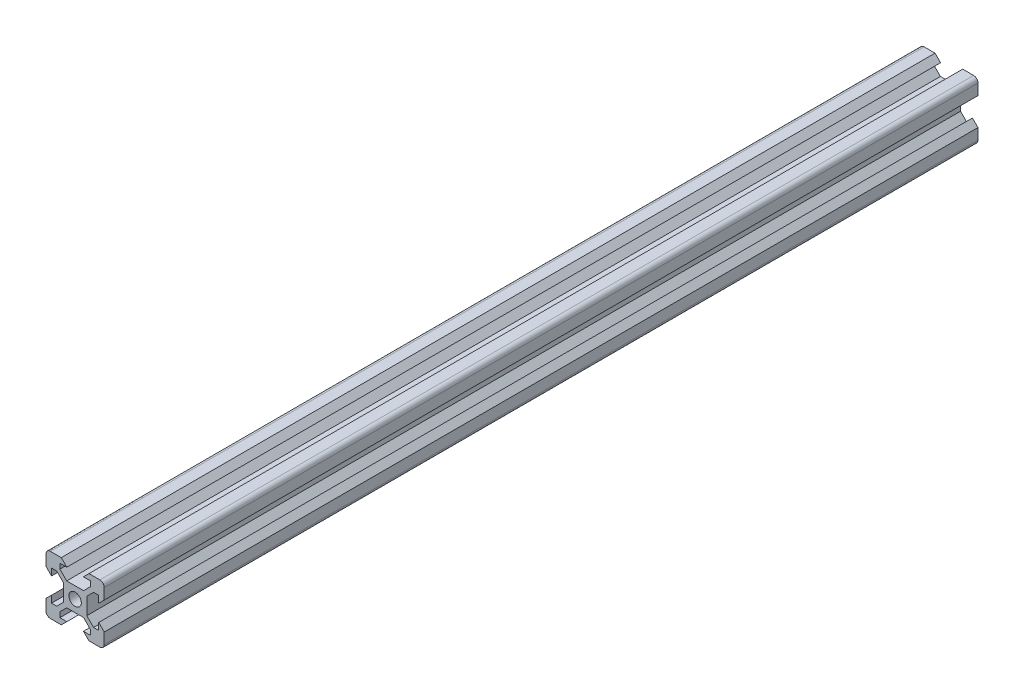
from build123d import *

# Parameters (mm, degrees)
SKETCH1_R           = 2.125
BOSS_EXTRUDE1_DEPTH = 300


with BuildPart() as part:
    # Sketch1 → Boss-Extrude1 (new body)
    with BuildSketch(Plane.XY):
        with BuildLine():
            Line((8.1, 5.225), (8.1, 2.85))
            Line((8.1, 2.85), (10, 4.75))
            Line((10, 4.75), (10, 8.5))
            ThreePointArc((10, 8.5), (9.560660172, 9.560660172), (8.5, 10))
            Line((8.5, 10), (4.75, 10))
            Line((4.75, 10), (2.85, 8.1))
            Line((2.85, 8.1), (5.225, 8.1))
            Line((5.225, 8.1), (5.225, 6.325))
            Line((5.225, 6.325), (2.9, 4))
            Line((2.9, 4), (-2.9, 4))
            Line((-2.9, 4), (-5.225, 6.325))
            Line((-5.225, 6.325), (-5.225, 8.1))
            Line((-5.225, 8.1), (-2.85, 8.1))
            Line((-2.85, 8.1), (-4.75, 10))
            Line((-4.75, 10), (-8.5, 10))
            ThreePointArc((-8.5, 10), (-9.560660172, 9.560660172), (-10, 8.5))
            Line((-10, 8.5), (-10, 4.75))
            Line((-10, 4.75), (-8.1, 2.85))
            Line((-8.1, 2.85), (-8.1, 5.225))
            Line((-8.1, 5.225), (-6.325, 5.225))
            Line((-6.325, 5.225), (-4, 2.9))
            Line((-4, 2.9), (-4, -2.9))
            Line((-4, -2.9), (-6.325, -5.225))
            Line((-6.325, -5.225), (-8.1, -5.225))
            Line((-8.1, -5.225), (-8.1, -2.85))
            Line((-8.1, -2.85), (-10, -4.75))
            Line((-10, -4.75), (-10, -8.5))
            ThreePointArc((-10, -8.5), (-9.560660172, -9.560660172), (-8.5, -10))
            Line((-8.5, -10), (-4.75, -10))
            Line((-4.75, -10), (-2.85, -8.1))
            Line((-2.85, -8.1), (-5.225, -8.1))
            Line((-5.225, -8.1), (-5.225, -6.325))
            Line((-5.225, -6.325), (-2.9, -4))
            Line((-2.9, -4), (2.9, -4))
            Line((2.9, -4), (5.225, -6.325))
            Line((5.225, -6.325), (5.225, -8.1))
            Line((5.225, -8.1), (2.85, -8.1))
            Line((2.85, -8.1), (4.75, -10))
            Line((4.75, -10), (8.5, -10))
            ThreePointArc((8.5, -10), (9.560660172, -9.560660172), (10, -8.5))
            Line((10, -8.5), (10, -4.75))
            Line((10, -4.75), (8.1, -2.85))
            Line((8.1, -2.85), (8.1, -5.225))
            Line((8.1, -5.225), (6.325, -5.225))
            Line((6.325, -5.225), (4, -2.9))
            Line((4, -2.9), (4, 2.9))
            Line((4, 2.9), (6.325, 5.225))
            Line((6.325, 5.225), (8.1, 5.225))
        make_face()
        Circle(SKETCH1_R, mode=Mode.SUBTRACT)
    extrude(amount=BOSS_EXTRUDE1_DEPTH)


solid = part.part
